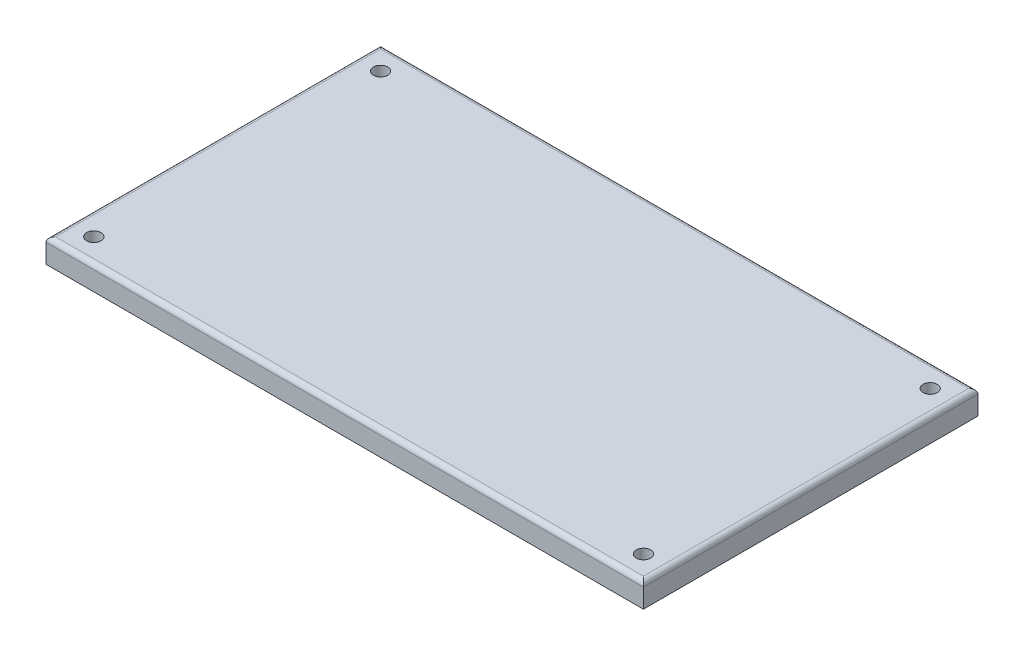
from build123d import *

# Parameters (mm, degrees)
SKETCH1_W           = 125
SKETCH1_H           = 70
BOSS_EXTRUDE1_DEPTH = 5
FILLET1_R           = 1
CUT_EXTRUDE1_REACH  = 145.353
SKETCH2_R           = 1.5


with BuildPart() as part:
    # Sketch1 → Boss-Extrude1 (new body)
    with BuildSketch(Plane(origin=(0, 0, 0), x_dir=(1, 0, 0), z_dir=(0, 1, 0))):
        with Locations((62.5, 35)):
            Rectangle(SKETCH1_W, SKETCH1_H)
    extrude(amount=BOSS_EXTRUDE1_DEPTH)

    # Fillet1
    fillet1_edges = [part.edges().sort_by_distance(p)[0] for p in [
        (125, 5, -35),
        (62.5, 5, -70),
        (0, 5, -35),
        (62.5, 5, 0),
    ]]
    fillet(fillet1_edges, radius=FILLET1_R)

    # Sketch2 → Cut-Extrude1 (cut, up to next)
    with BuildSketch(Plane(origin=(0, 5, 0), x_dir=(1, 0, 0), z_dir=(0, 1, 0)), mode=Mode.PRIVATE) as cut_extrude1_sk1:
        with Locations(Location((120, 5, 0), (0, 0, 270))):
            Circle(SKETCH2_R)
    cut_extrude1_tool1 = extrude(cut_extrude1_sk1.sketch, amount=-CUT_EXTRUDE1_REACH, mode=Mode.PRIVATE) & part.part
    # Sketch2 → Cut-Extrude1 (cut, up to next)
    with BuildSketch(Plane(origin=(0, 5, 0), x_dir=(1, 0, 0), z_dir=(0, 1, 0)), mode=Mode.PRIVATE) as cut_extrude1_sk2:
        with Locations(Location((120, 65, 0), (0, 0, 90))):
            Circle(SKETCH2_R)
    cut_extrude1_tool2 = extrude(cut_extrude1_sk2.sketch, amount=-CUT_EXTRUDE1_REACH, mode=Mode.PRIVATE) & part.part
    # Sketch2 → Cut-Extrude1 (cut, up to next)
    with BuildSketch(Plane(origin=(0, 5, 0), x_dir=(1, 0, 0), z_dir=(0, 1, 0)), mode=Mode.PRIVATE) as cut_extrude1_sk3:
        with Locations(Location((5, 65, 0), (0, 0, 270))):
            Circle(SKETCH2_R)
    cut_extrude1_tool3 = extrude(cut_extrude1_sk3.sketch, amount=-CUT_EXTRUDE1_REACH, mode=Mode.PRIVATE) & part.part
    # Sketch2 → Cut-Extrude1 (cut, up to next)
    with BuildSketch(Plane(origin=(0, 5, 0), x_dir=(1, 0, 0), z_dir=(0, 1, 0)), mode=Mode.PRIVATE) as cut_extrude1_sk4:
        with Locations(Location((5, 5, 0), (0, 0, 90))):
            Circle(SKETCH2_R)
    cut_extrude1_tool4 = extrude(cut_extrude1_sk4.sketch, amount=-CUT_EXTRUDE1_REACH, mode=Mode.PRIVATE) & part.part
    add(cut_extrude1_tool1.solids().sort_by_distance((120, 5, -5))[0], mode=Mode.SUBTRACT)
    add(cut_extrude1_tool2.solids().sort_by_distance((120, 5, -65))[0], mode=Mode.SUBTRACT)
    add(cut_extrude1_tool3.solids().sort_by_distance((5, 5, -65))[0], mode=Mode.SUBTRACT)
    add(cut_extrude1_tool4.solids().sort_by_distance((5, 5, -5))[0], mode=Mode.SUBTRACT)


solid = part.part
